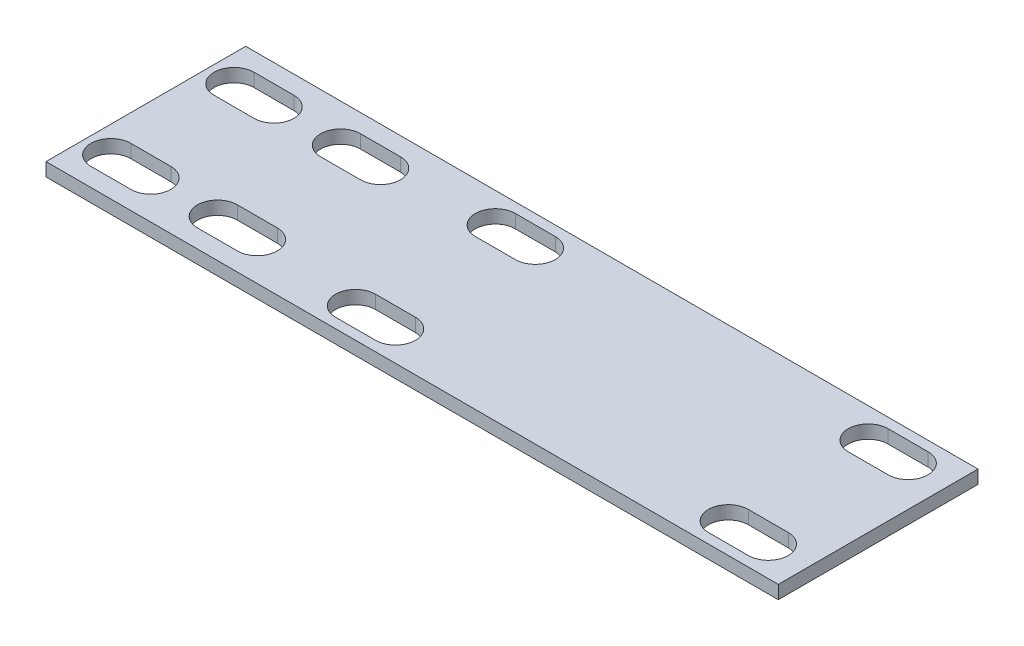
from build123d import *

# Parameters (mm, degrees)
EXTRUDE_1_DEPTH = 2


with BuildPart() as part:
    # 草图1 → 凸台-拉伸1 (new body)
    with BuildSketch(Plane(origin=(0, 0, 0), x_dir=(1, 0, 0), z_dir=(0, 1, 0))):
        Polygon((0, 5.75), (0, 0), (110, 0), (110, 30), (0, 30), (0, 15), align=None)
        with BuildLine():
            ThreePointArc((4, 2.75), (1, 5.75), (4, 8.75))
            Line((4, 8.75), (10, 8.75))
            ThreePointArc((10, 8.75), (13, 5.75), (10, 2.75))
            Line((10, 2.75), (4, 2.75))
        make_face(mode=Mode.SUBTRACT)
        with BuildLine():
            ThreePointArc((20, 2.75), (17, 5.75), (20, 8.75))
            Line((20, 8.75), (26, 8.75))
            ThreePointArc((26, 8.75), (29, 5.75), (26, 2.75))
            Line((26, 2.75), (20, 2.75))
        make_face(mode=Mode.SUBTRACT)
        with BuildLine():
            ThreePointArc((42, 1.5), (39, 4.5), (42, 7.5))
            Line((42, 7.5), (48, 7.5))
            ThreePointArc((48, 7.5), (51, 4.5), (48, 1.5))
            Line((48, 1.5), (42, 1.5))
        make_face(mode=Mode.SUBTRACT)
        with BuildLine():
            ThreePointArc((98, 1.5), (95, 4.5), (98, 7.5))
            Line((98, 7.5), (104, 7.5))
            ThreePointArc((104, 7.5), (107, 4.5), (104, 1.5))
            Line((104, 1.5), (98, 1.5))
        make_face(mode=Mode.SUBTRACT)
        with BuildLine():
            Line((10, 21.25), (4, 21.25))
            ThreePointArc((4, 21.25), (1, 24.25), (4, 27.25))
            Line((4, 27.25), (10, 27.25))
            ThreePointArc((10, 27.25), (13, 24.25), (10, 21.25))
        make_face(mode=Mode.SUBTRACT)
        with BuildLine():
            Line((26, 21.25), (20, 21.25))
            ThreePointArc((20, 21.25), (17, 24.25), (20, 27.25))
            Line((20, 27.25), (26, 27.25))
            ThreePointArc((26, 27.25), (29, 24.25), (26, 21.25))
        make_face(mode=Mode.SUBTRACT)
        with BuildLine():
            Line((48, 22.5), (42, 22.5))
            ThreePointArc((42, 22.5), (39, 25.5), (42, 28.5))
            Line((42, 28.5), (48, 28.5))
            ThreePointArc((48, 28.5), (51, 25.5), (48, 22.5))
        make_face(mode=Mode.SUBTRACT)
        with BuildLine():
            Line((104, 22.5), (98, 22.5))
            ThreePointArc((98, 22.5), (95, 25.5), (98, 28.5))
            Line((98, 28.5), (104, 28.5))
            ThreePointArc((104, 28.5), (107, 25.5), (104, 22.5))
        make_face(mode=Mode.SUBTRACT)
    extrude(amount=EXTRUDE_1_DEPTH)


solid = part.part
